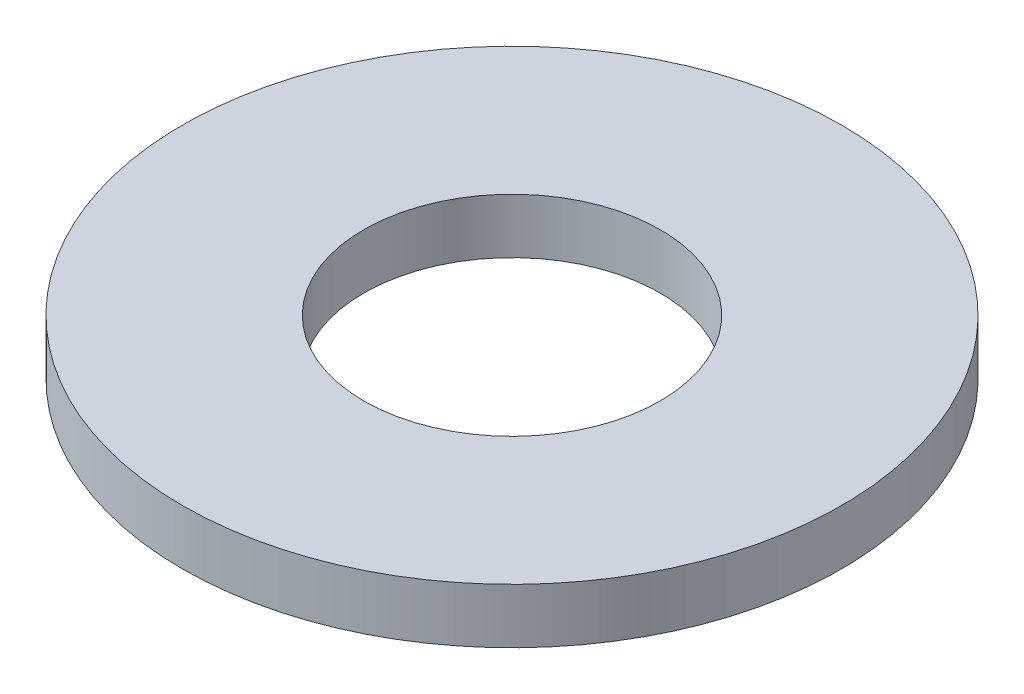
from build123d import *

# Parameters (mm, degrees)
CROQUIS1_R              = 3
CROQUIS1_R_2            = 1.35
SALIENTE_EXTRUIR1_DEPTH = 0.5


with BuildPart() as part:
    # Croquis1 → Saliente-Extruir1 (new body)
    with BuildSketch(Plane(origin=(0, 0, 0), x_dir=(1, 0, 0), z_dir=(0, 1, 0))):
        with Locations(Location((0, 0, 0), (0, 0, 270))):
            Circle(CROQUIS1_R)
        with Locations(Location((0, 0, 0), (0, 0, 270))):
            Circle(CROQUIS1_R_2, mode=Mode.SUBTRACT)
    extrude(amount=SALIENTE_EXTRUIR1_DEPTH)


solid = part.part
